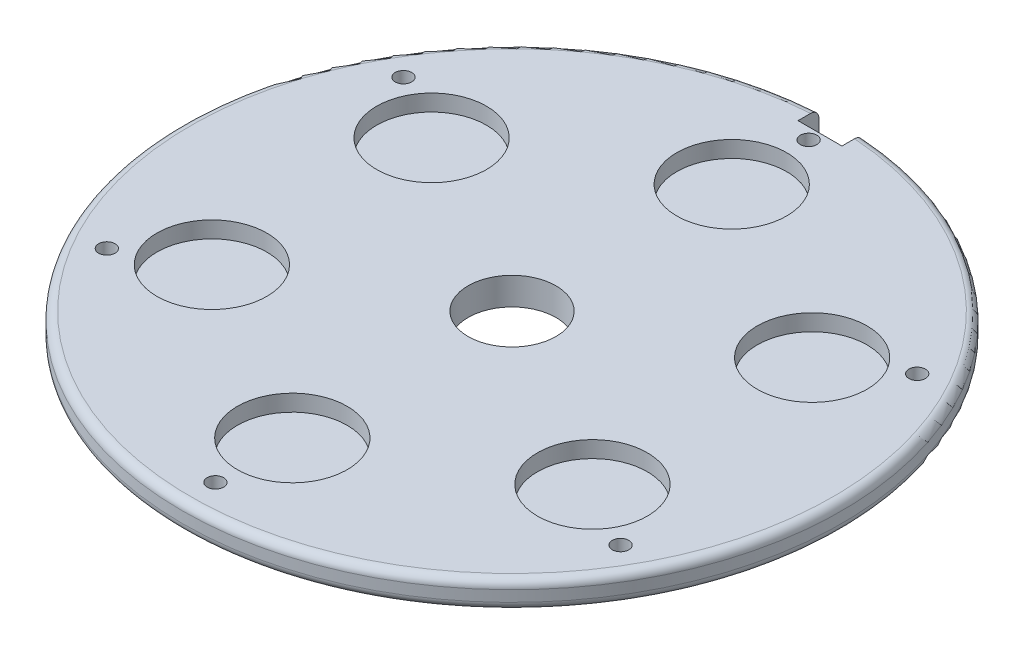
from build123d import *

# Parameters (mm, degrees)
SKETCH2_R           = 60
BOSS_EXTRUDE1_DEPTH = 5
SKETCH3_R           = 8
CUT_EXTRUDE1_DEPTH  = 86
SKETCH4_R           = 10
CUT_EXTRUDE2_DEPTH  = 3
CIRPATTERN1_COUNT   = 6
SKETCH5_R           = 1.5
CUT_EXTRUDE3_DEPTH  = 86
CIRPATTERN2_COUNT   = 6
SKETCH6_W           = 8
SKETCH6_H           = 4
CUT_EXTRUDE4_DEPTH  = 86
FILLET1_R           = 1.5


with BuildPart() as part:
    # Sketch2 → Boss-Extrude1 (new body)
    with BuildSketch(Plane(origin=(0, 0, 0), x_dir=(1, 0, 0), z_dir=(0, 1, 0))):
        with Locations(Location((0, 0, 0), (0, 0, 270))):
            Circle(SKETCH2_R)
    extrude(amount=BOSS_EXTRUDE1_DEPTH)

    # Sketch3 → Cut-Extrude1 (cut, through all)
    with BuildSketch(Plane(origin=(0, 5, 0), x_dir=(1, 0, 0), z_dir=(0, 1, 0))):
        with Locations(Location((0, 0, 0), (0, 0, 270))):
            Circle(SKETCH3_R)
    extrude(amount=-CUT_EXTRUDE1_DEPTH, mode=Mode.SUBTRACT)

    # Sketch4 → Cut-Extrude2 (cut)
    with BuildSketch(Plane(origin=(0, 5, 0), x_dir=(1, 0, 0), z_dir=(0, 1, 0))):
        with Locations(Location((0, 40, 0), (0, 0, 270))):
            Circle(SKETCH4_R)
    cut_extrude2 = extrude(amount=-CUT_EXTRUDE2_DEPTH, mode=Mode.SUBTRACT)

    # CirPattern1: Cut-Extrude2 ×6 about axis
    cirpattern1_axis = Axis((0, 0, 0), (0, 1, 0))
    for i in range(1, CIRPATTERN1_COUNT):
        add(cut_extrude2.rotate(cirpattern1_axis, i * 360 / CIRPATTERN1_COUNT), mode=Mode.SUBTRACT)

    # Sketch5 → Cut-Extrude3 (cut, through all)
    with BuildSketch(Plane(origin=(0, 5, 0), x_dir=(1, 0, 0), z_dir=(0, 1, 0))):
        with Locations(Location((0, 54, 0), (0, 0, 270))):
            Circle(SKETCH5_R)
    cut_extrude3 = extrude(amount=-CUT_EXTRUDE3_DEPTH, mode=Mode.SUBTRACT)

    # CirPattern2: Cut-Extrude3 ×6 about axis
    cirpattern2_axis = Axis((0, 0, 0), (0, 1, 0))
    for i in range(1, CIRPATTERN2_COUNT):
        add(cut_extrude3.rotate(cirpattern2_axis, i * 360 / CIRPATTERN2_COUNT), mode=Mode.SUBTRACT)

    # Sketch6 → Cut-Extrude4 (cut, through all)
    with BuildSketch(Plane(origin=(0, 5, 0), x_dir=(1, 0, 0), z_dir=(0, 1, 0))):
        with Locations((0, 58.067002871)):
            Rectangle(SKETCH6_W, SKETCH6_H)
    extrude(amount=-CUT_EXTRUDE4_DEPTH, mode=Mode.SUBTRACT)

    # Fillet1
    fillet1_edges = [part.edges().sort_by_distance(p)[0] for p in [
        (59.966620262, 0, 2.001113277),
        (-59.966620262, 5, 2.001113277),
    ]]
    fillet(fillet1_edges, radius=FILLET1_R)


solid = part.part
